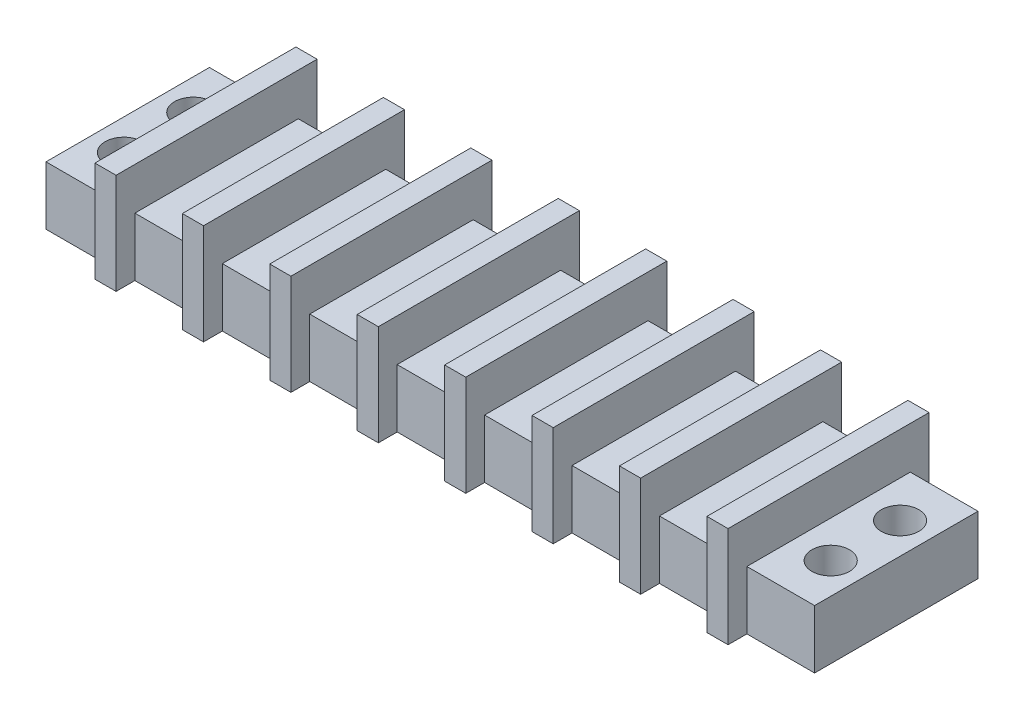
from build123d import *

# Parameters (mm, degrees)
SKETCH1_W               = 83.0326
SKETCH1_H               = 17.653
BOSS_EXTRUDE1_DEPTH     = 6.3119
SKETCH5_W               = 2.286
SKETCH5_H               = 21.717
BOSS_EXTRUDE5_DEPTH     = 10.8712
LPATTERN2_COUNT         = 8
LPATTERN2_PITCH         = 9.445171429
SKETCH9_R               = 2.032
CUT_EXTRUDE1_DEPTH      = 86.567236542
MIRROR2_COPY_1_SKETCH_R = 2.032
MIRROR2_COPY_1_DEPTH    = 86.567236542


with BuildPart() as part:
    # Sketch1 → Boss-Extrude1 (new body)
    with BuildSketch(Plane(origin=(0, 0, 0), x_dir=(1, 0, 0), z_dir=(0, 1, 0))):
        with Locations((41.5163, 8.8265)):
            Rectangle(SKETCH1_W, SKETCH1_H)
    extrude(amount=BOSS_EXTRUDE1_DEPTH)

    # Sketch5 → Boss-Extrude5 (add)
    with BuildSketch(Plane.XZ):
        with Locations((8.4582, -8.8265)):
            Rectangle(SKETCH5_W, SKETCH5_H)
    boss_extrude5 = extrude(amount=-BOSS_EXTRUDE5_DEPTH)

    # LPattern2: Boss-Extrude5 ×8
    with Locations(*[(i * LPATTERN2_PITCH, 0, 0) for i in range(1, LPATTERN2_COUNT)]):
        add(boss_extrude5)

    # Sketch9 → Cut-Extrude1 (cut, through all)
    with BuildSketch(Plane(origin=(0, 6.3119, 0), x_dir=(1, 0, 0), z_dir=(0, 1, 0))):
        with Locations(Location((3.3401, 5.08, 0), (0, 0, 270))):
            Circle(SKETCH9_R)
    cut_extrude1 = extrude(amount=-CUT_EXTRUDE1_DEPTH, mode=Mode.SUBTRACT)

    # Mirror1: Cut-Extrude1 across plane
    add(cut_extrude1.mirror(Plane.XY.offset(-8.8265)), mode=Mode.SUBTRACT)

    # Mirror2: Cut-Extrude1 across plane
    add(cut_extrude1.mirror(Plane.ZY.offset(-41.5163)), mode=Mode.SUBTRACT)

    # Mirror2 copy 1 sketch → Mirror2 copy 1 (cut, through all)
    with BuildSketch(Plane(origin=(83.0326, 6.3119, -17.653), x_dir=(-1, 0, 0), z_dir=(0, 1, 0))):
        with Locations(Location((3.3401, 5.08, 0), (0, 0, 270))):
            Circle(MIRROR2_COPY_1_SKETCH_R)
    extrude(amount=-MIRROR2_COPY_1_DEPTH, mode=Mode.SUBTRACT)


solid = part.part
